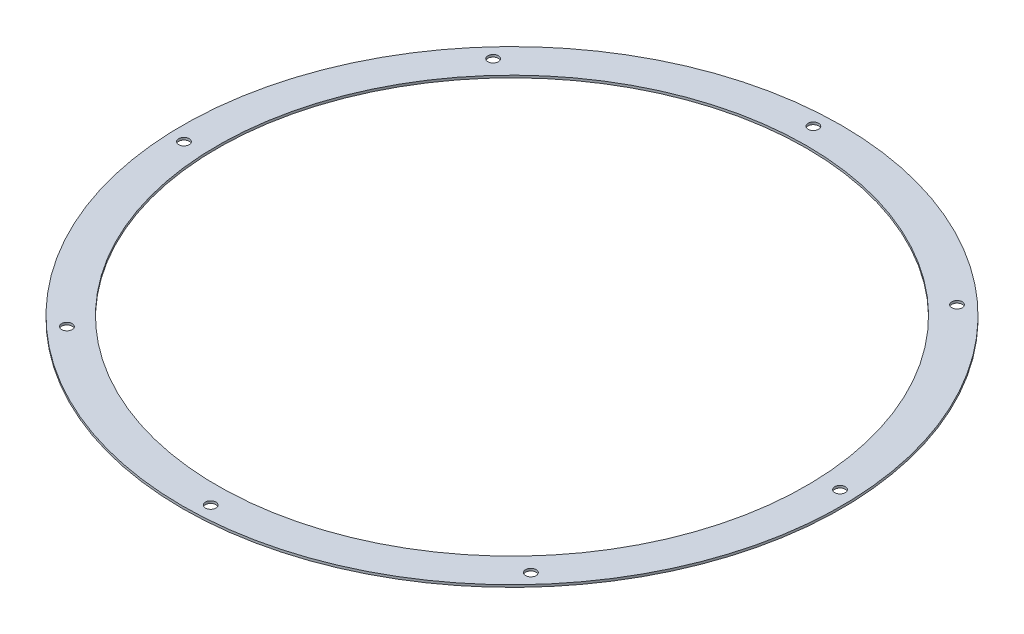
from build123d import *

# Parameters (mm, degrees)
SKETCH1_R           = 282.5
SKETCH1_R_2         = 252.5
BOSS_EXTRUDE1_DEPTH = 2
SKETCH2_R           = 4.5
CUT_EXTRUDE1_DEPTH  = 5
CIRPATTERN1_COUNT   = 8


with BuildPart() as part:
    # Sketch1 → Boss-Extrude1 (new body)
    with BuildSketch(Plane(origin=(0, 0, 0), x_dir=(1, 0, 0), z_dir=(0, 1, 0))):
        with Locations(Location((0, 0, 0), (0, 0, 270))):
            Circle(SKETCH1_R)
        with Locations(Location((0, 0, 0), (0, 0, 270))):
            Circle(SKETCH1_R_2, mode=Mode.SUBTRACT)
    extrude(amount=BOSS_EXTRUDE1_DEPTH)

    # Sketch2 → Cut-Extrude1 (cut)
    with BuildSketch(Plane(origin=(0, 2, 0), x_dir=(1, 0, 0), z_dir=(0, 1, 0))):
        with Locations(Location((-11.443421424, 269.757387491, 0), (0, 0, 270))):
            Circle(SKETCH2_R)
    cut_extrude1 = extrude(amount=-CUT_EXTRUDE1_DEPTH, mode=Mode.SUBTRACT)

    # CirPattern1: Cut-Extrude1 ×8 about axis
    cirpattern1_axis = Axis((0, 0, 0), (0, 1, 0))
    for i in range(1, CIRPATTERN1_COUNT):
        add(cut_extrude1.rotate(cirpattern1_axis, i * 360 / CIRPATTERN1_COUNT), mode=Mode.SUBTRACT)


solid = part.part
